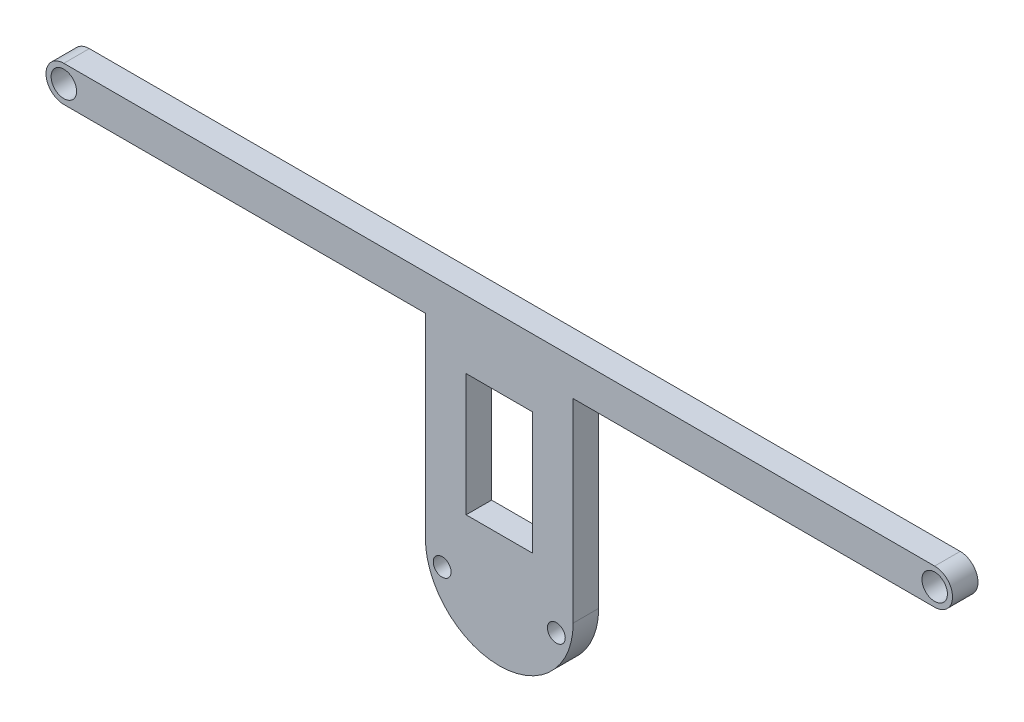
from build123d import *

# Parameters (mm, degrees)
SKETCH_1_R      = 2.5
SKETCH_1_R_2    = 1.75
SKETCH_1_W      = 13
SKETCH_1_H      = 24
EXTRUDE_1_DEPTH = 5


with BuildPart() as part:
    # 스케치1 → 보스-돌출1 (new body)
    with BuildSketch(Plane.XY):
        with BuildLine():
            Line((-85.42, 22.575), (85.42, 22.575))
            ThreePointArc((85.42, 22.575), (88.92, 19.075), (85.42, 15.575))
            Line((85.42, 15.575), (14.5, 15.575))
            Line((14.5, 15.575), (14.5, -22.575))
            ThreePointArc((14.5, -22.575), (0, -37.075), (-14.5, -22.575))
            Line((-14.5, -22.575), (-14.5, 15.575))
            Line((-14.5, 15.575), (-85.42, 15.575))
            ThreePointArc((-85.42, 15.575), (-88.92, 19.075), (-85.42, 22.575))
        make_face()
        with Locations((-85.42, 19.075)):
            Circle(SKETCH_1_R, mode=Mode.SUBTRACT)
        with Locations((85.42, 19.075)):
            Circle(SKETCH_1_R, mode=Mode.SUBTRACT)
        with Locations((-11.199423754, -25.875576246)):
            Circle(SKETCH_1_R_2, mode=Mode.SUBTRACT)
        with Locations((11.199423754, -25.875576246)):
            Circle(SKETCH_1_R_2, mode=Mode.SUBTRACT)
        with Locations((0, -2.676152492)):
            Rectangle(SKETCH_1_W, SKETCH_1_H, mode=Mode.SUBTRACT)
    extrude(amount=EXTRUDE_1_DEPTH)


solid = part.part
